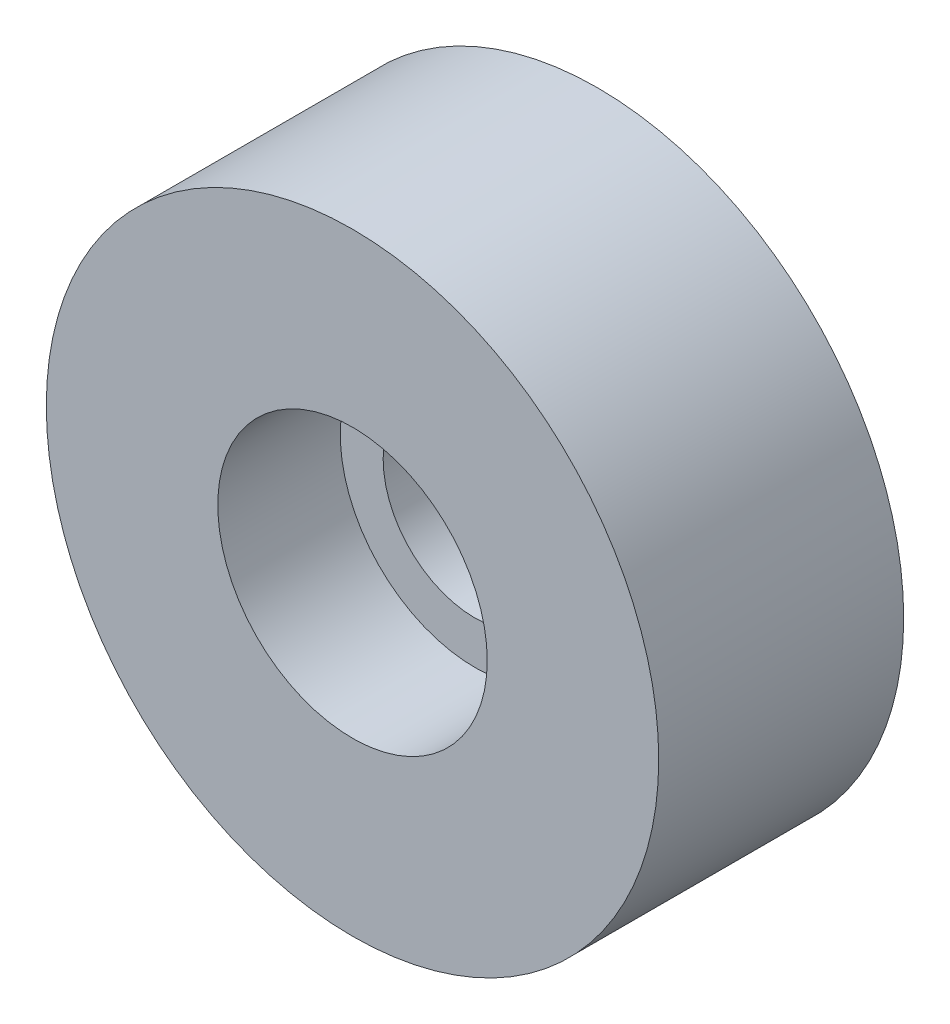
from build123d import *

# Parameters (mm, degrees)
ESQUISSE1_R             = 5
BOSS_EXTRU_1_DEPTH      = 4
ESQUISSE2_R             = 2.2
ENL_V_MAT_EXTRU_1_DEPTH = 2
ESQUISSE3_R             = 1.5
ENL_V_MAT_EXTRU_2_DEPTH = 9.124038405


with BuildPart() as part:
    # Esquisse1 → Boss.-Extru.1 (new body)
    with BuildSketch(Plane.XY):
        Circle(ESQUISSE1_R)
    extrude(amount=BOSS_EXTRU_1_DEPTH)

    # Esquisse2 → Enlèv. mat.-Extru.1 (cut)
    with BuildSketch(Plane.XY.offset(4)):
        Circle(ESQUISSE2_R)
    extrude(amount=-ENL_V_MAT_EXTRU_1_DEPTH, mode=Mode.SUBTRACT)

    # Esquisse3 → Enlèv. mat.-Extru.2 (cut, through all)
    with BuildSketch(Plane(origin=(0, 0, 0), x_dir=(-1, 0, 0), z_dir=(0, 0, -1))):
        Circle(ESQUISSE3_R)
    extrude(amount=-ENL_V_MAT_EXTRU_2_DEPTH, mode=Mode.SUBTRACT)


solid = part.part
